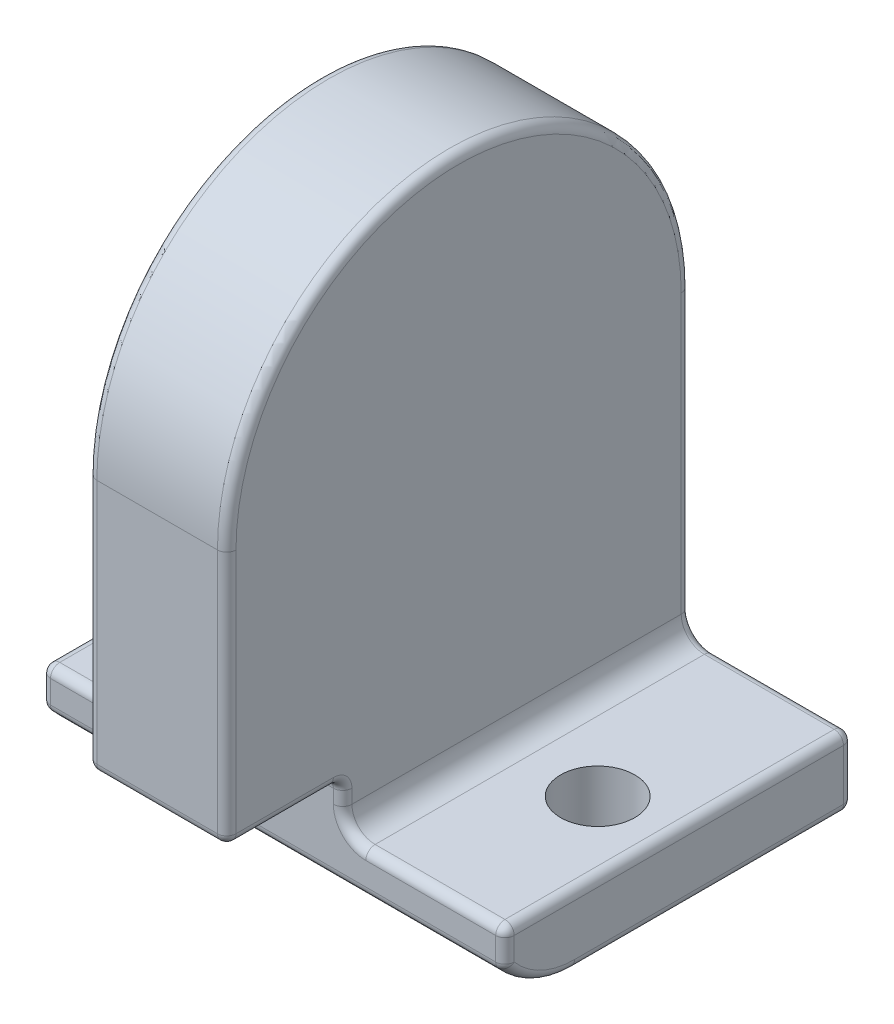
from build123d import *

# Parameters (mm, degrees)
SKETCH_1_R          = 3
EXTRUDE_1_DEPTH     = 3
SKETCH_2_W          = 10
SKETCH_2_H          = 10
SKETCH_2_R          = 0.8
EXTRUDE_2_DEPTH     = 1.5
SKETCH_5_W          = 10
SKETCH_5_H          = 2.5
CUT_EXTRUDE_1_DEPTH = 2.5
CUT_EXTRUDE_2_REACH = 15.748
FILLET_1_R          = 0.5
FILLET_2_R          = 0.2
CHAMFER_1_SIZE      = 0.2
SKETCH_3_R          = 3.977941141
EXTRUDE_3_DEPTH     = 0.4


with BuildPart() as part:
    # 草图1 → 凸台-拉伸1 (new body)
    with BuildSketch(Plane(origin=(0, 0, 0), x_dir=(0, 0, -1), z_dir=(1, 0, 0))):
        with BuildLine():
            Line((-5, 0), (-5, -8))
            Line((-5, -8), (5, -8))
            Line((5, -8), (5, 0))
            ThreePointArc((5, 0), (0, 5), (-5, 0))
        make_face()
        Circle(SKETCH_1_R, mode=Mode.SUBTRACT)
    extrude(amount=EXTRUDE_1_DEPTH)

    # 草图2 → 凸台-拉伸2 (add)
    with BuildSketch(Plane.XZ.offset(8)):
        with Locations((1.5, 0)):
            Rectangle(SKETCH_2_W, SKETCH_2_H)
        with Locations(Location((5, -1, 0), (0, 0, 270))):
            Circle(SKETCH_2_R, mode=Mode.SUBTRACT)
        with Locations(Location((-2, -1, 0), (0, 0, 270))):
            Circle(SKETCH_2_R, mode=Mode.SUBTRACT)
    extrude(amount=-EXTRUDE_2_DEPTH)

    # 草图5 → 切除-拉伸1 (cut)
    with BuildSketch(Plane.XZ.offset(8)):
        with Locations((1.5, 3.75)):
            Rectangle(SKETCH_5_W, SKETCH_5_H)
    extrude(amount=-CUT_EXTRUDE_1_DEPTH, mode=Mode.SUBTRACT)

    # 草图6 → 切除-拉伸2 (cut, up to next)
    with BuildSketch(Plane.ZY.offset(3.5), mode=Mode.PRIVATE) as cut_extrude_2_sk1:
        with BuildLine():
            Line((2.897366596, -6), (3.27705392, -6))
            Line((3.27705392, -6), (3.27705392, -8.325127743))
            Line((3.27705392, -8.325127743), (1, -8.325127743))
            Line((1, -8.325127743), (1, -8))
            ThreePointArc((1, -8), (2.378404875, -7.407669683), (2.897366596, -6))
        make_face()
    cut_extrude_2_tool1 = extrude(cut_extrude_2_sk1.sketch, amount=-CUT_EXTRUDE_2_REACH, mode=Mode.PRIVATE) & part.part
    add(cut_extrude_2_tool1.solids().sort_by_distance((-3.5, -7.575754, 2.569334))[0], mode=Mode.SUBTRACT)

    # 圆角1
    fillet_1_edges = [part.edges().sort_by_distance(p)[0] for p in [
        (3, -6.5, -1.25),
        (0, -6.5, -1.25),
    ]]
    fillet(fillet_1_edges, radius=FILLET_1_R)

    # 圆角2
    fillet_2_edges = [part.edges().sort_by_distance(p)[0] for p in [
        (-2, -6.5, -5),
        (-3.5, -7.25, -5),
        (6.5, -6.5, -1.25),
        (6.5, -7.25, -5),
        (6.5, -8, -2),
        (3, 5, 0),
        (-3.5, -6.5, -1.25),
        (3, -5.5, 3.75),
        (-3.5, -6.883095189, 2.5),
        (1.5, -5.5, 5),
        (0, -2.75, 5),
        (-2, -6.5, 2.5),
        (1.5, -5.5, 2.5),
        (6.5, -6.883095189, 2.5),
        (0, -5.5, 3.75),
        (0, 5, 0),
        (3, -2.75, 5),
        (-3.5, -8, -2),
        (1.5, -8, -5),
        (1.5, -7.266190379, 2.5),
        (-3.5, -7.806716397, 1.834936608),
        (6.5, -7.806716397, 1.834936608),
        (0, -5.75, 2.5),
        (0, -3, -5),
        (3, -5.75, 2.5),
        (3, -3, -5),
        (5, -6.5, 2.5),
        (5, -6.5, -5),
        (-0.146446609, -6.353553391, -5),
        (-0.146446609, -6.353553391, 2.5),
        (3.146446609, -6.353553391, -5),
        (3.146446609, -6.353553391, 2.5),
    ]]
    fillet(fillet_2_edges, radius=FILLET_2_R)

    # 倒角1
    chamfer_1_edges = [part.edges().sort_by_distance(p)[0] for p in [
        (0, 0, 3),
        (3, 0, 3),
    ]]
    chamfer(chamfer_1_edges, length=CHAMFER_1_SIZE)

    # 草图3 → 凸台-拉伸3 (add)
    with BuildSketch(Plane(origin=(3, 0, 0), x_dir=(0, 0, -1), z_dir=(1, 0, 0))):
        Circle(SKETCH_3_R)
    extrude(amount=-EXTRUDE_3_DEPTH)


solid = part.part
